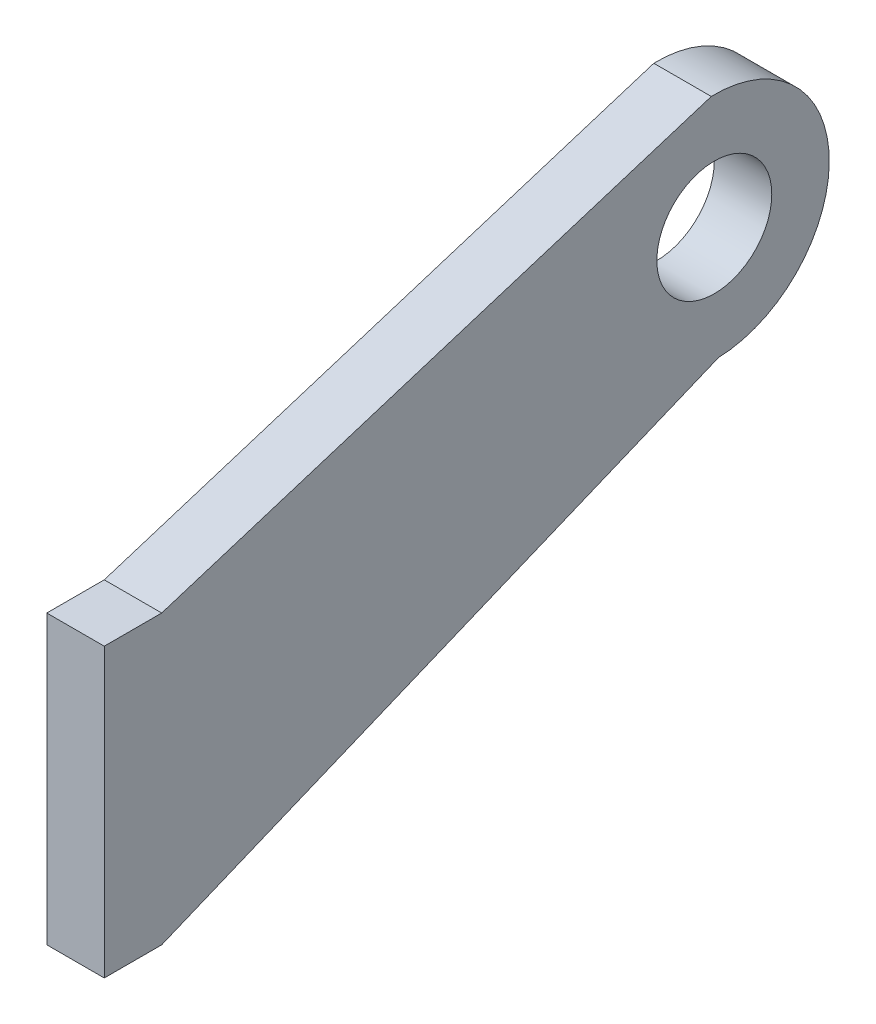
from build123d import *

# Parameters (mm, degrees)
SKETCH1_R           = 2
BOSS_EXTRUDE1_DEPTH = 2


with BuildPart() as part:
    # Sketch1 → Boss-Extrude1 (new body)
    with BuildSketch(Plane(origin=(0, 0, 0), x_dir=(0, 0, -1), z_dir=(1, 0, 0))):
        with BuildLine():
            Line((-0.003608009, 4.426390949), (19.120298853, 10.431566954))
            ThreePointArc((19.120298853, 10.431566954), (23.223332093, 6.557543739), (19.369494044, 2.435545445))
            Line((19.369494044, 2.435545445), (-0.003608009, -5.573609051))
            Line((-0.003608009, -5.573609051), (-2.003608009, -5.573609051))
            Line((-2.003608009, -5.573609051), (-2.003608009, 4.426390949))
            Line((-2.003608009, 4.426390949), (-0.003608009, 4.426390949))
        make_face()
        with Locations((19.225273181, 6.432944643)):
            Circle(SKETCH1_R, mode=Mode.SUBTRACT)
    extrude(amount=BOSS_EXTRUDE1_DEPTH)


solid = part.part
